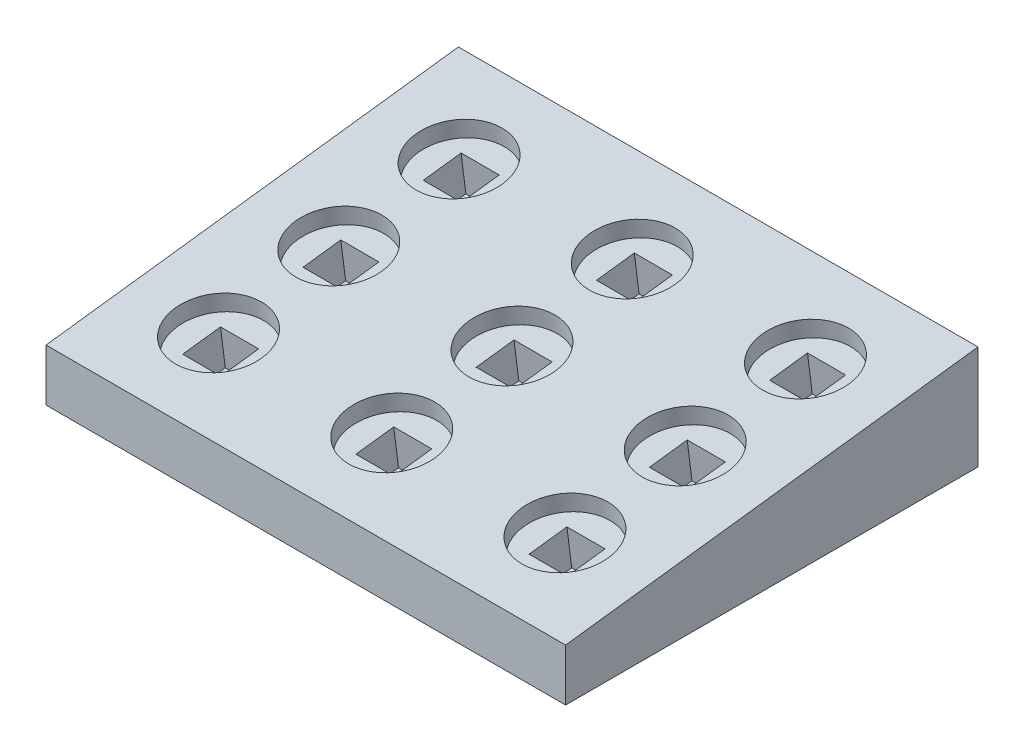
from build123d import *

# Parameters (mm, degrees)
BOSS_EXTRUDE1_DEPTH = 381
SKETCH2_R           = 31.75
SKETCH2_W           = 27.94
SKETCH2_H           = 27.94
CUT_EXTRUDE2_DEPTH  = 15.24
SKETCH2_3_W         = 27.94
SKETCH2_3_H         = 27.94
CUT_EXTRUDE3_DEPTH  = 43.18
SHELL1_T            = -3.81


with BuildPart() as part:
    # Sketch1 → Boss-Extrude1 (new body)
    with BuildSketch(Plane(origin=(0, 0, 0), x_dir=(0, 0, -1), z_dir=(1, 0, 0))):
        Polygon((0, 0), (0, 38.1), (302.409374855, 76.2), (302.409374855, 0), align=None)
    extrude(amount=BOSS_EXTRUDE1_DEPTH)

    # Sketch2 → Cut-Extrude2 (cut)
    # profile 1 of 9: a face of its own
    with BuildSketch(Plane(origin=(0, 40.024765624, 5.042646482), x_dir=(1, 0, 0), z_dir=(0, 0.9921567416492215, 0.12500000000000003))):
        with Locations((63.5, 246.0625)):
            Circle(SKETCH2_R)
        with Locations((63.5, 246.0625)):
            Rectangle(SKETCH2_W, SKETCH2_H, mode=Mode.SUBTRACT)
    # profile 2 of 9: a face of its own
    with BuildSketch(Plane(origin=(0, 40.024765624, 5.042646482), x_dir=(1, 0, 0), z_dir=(0, 0.9921567416492215, 0.12500000000000003))):
        with Locations((190.5, 246.0625)):
            Circle(SKETCH2_R)
        with Locations((190.5, 246.0625)):
            Rectangle(SKETCH2_W, SKETCH2_H, mode=Mode.SUBTRACT)
    # profile 3 of 9: a face of its own
    with BuildSketch(Plane(origin=(0, 40.024765624, 5.042646482), x_dir=(1, 0, 0), z_dir=(0, 0.9921567416492215, 0.12500000000000003))):
        with Locations((317.5, 246.0625)):
            Circle(SKETCH2_R)
        with Locations((317.5, 246.0625)):
            Rectangle(SKETCH2_W, SKETCH2_H, mode=Mode.SUBTRACT)
    # profile 4 of 9: a face of its own
    with BuildSketch(Plane(origin=(0, 40.024765624, 5.042646482), x_dir=(1, 0, 0), z_dir=(0, 0.9921567416492215, 0.12500000000000003))):
        with Locations((63.5, 157.1625)):
            Circle(SKETCH2_R)
        with Locations((63.5, 157.1625)):
            Rectangle(SKETCH2_W, SKETCH2_H, mode=Mode.SUBTRACT)
    # profile 5 of 9: a face of its own
    with BuildSketch(Plane(origin=(0, 40.024765624, 5.042646482), x_dir=(1, 0, 0), z_dir=(0, 0.9921567416492215, 0.12500000000000003))):
        with Locations((63.5, 68.2625)):
            Circle(SKETCH2_R)
        with Locations((63.5, 68.2625)):
            Rectangle(SKETCH2_W, SKETCH2_H, mode=Mode.SUBTRACT)
    # profile 6 of 9: a face of its own
    with BuildSketch(Plane(origin=(0, 40.024765624, 5.042646482), x_dir=(1, 0, 0), z_dir=(0, 0.9921567416492215, 0.12500000000000003))):
        with Locations((190.5, 157.1625)):
            Circle(SKETCH2_R)
        with Locations((190.5, 157.1625)):
            Rectangle(SKETCH2_W, SKETCH2_H, mode=Mode.SUBTRACT)
    # profile 7 of 9: a face of its own
    with BuildSketch(Plane(origin=(0, 40.024765624, 5.042646482), x_dir=(1, 0, 0), z_dir=(0, 0.9921567416492215, 0.12500000000000003))):
        with Locations((190.5, 68.2625)):
            Circle(SKETCH2_R)
        with Locations((190.5, 68.2625)):
            Rectangle(SKETCH2_W, SKETCH2_H, mode=Mode.SUBTRACT)
    # profile 8 of 9: a face of its own
    with BuildSketch(Plane(origin=(0, 40.024765624, 5.042646482), x_dir=(1, 0, 0), z_dir=(0, 0.9921567416492215, 0.12500000000000003))):
        with Locations((317.5, 68.2625)):
            Circle(SKETCH2_R)
        with Locations((317.5, 68.2625)):
            Rectangle(SKETCH2_W, SKETCH2_H, mode=Mode.SUBTRACT)
    # profile 9 of 9: a face of its own
    with BuildSketch(Plane(origin=(0, 40.024765624, 5.042646482), x_dir=(1, 0, 0), z_dir=(0, 0.9921567416492215, 0.12500000000000003))):
        with Locations((317.5, 157.1625)):
            Circle(SKETCH2_R)
        with Locations((317.5, 157.1625)):
            Rectangle(SKETCH2_W, SKETCH2_H, mode=Mode.SUBTRACT)
    extrude(amount=-CUT_EXTRUDE2_DEPTH, mode=Mode.SUBTRACT)

    # Sketch2<3> → Cut-Extrude3 (cut)
    with BuildSketch(Plane(origin=(0, 40.024765624, 5.042646482), x_dir=(1, 0, 0), z_dir=(0, 0.9921567416492215, 0.12500000000000003))):
        with Locations((317.5, 246.0625)):
            Rectangle(SKETCH2_3_W, SKETCH2_3_H)
        with Locations((190.5, 157.1625)):
            Rectangle(SKETCH2_3_W, SKETCH2_3_H)
        with Locations((317.5, 68.2625)):
            Rectangle(SKETCH2_3_W, SKETCH2_3_H)
        with Locations((190.5, 68.2625)):
            Rectangle(SKETCH2_3_W, SKETCH2_3_H)
        with Locations((190.5, 246.0625)):
            Rectangle(SKETCH2_3_W, SKETCH2_3_H)
        with Locations((63.5, 157.1625)):
            Rectangle(SKETCH2_3_W, SKETCH2_3_H)
        with Locations((317.5, 157.1625)):
            Rectangle(SKETCH2_3_W, SKETCH2_3_H)
        with Locations((63.5, 68.2625)):
            Rectangle(SKETCH2_3_W, SKETCH2_3_H)
        with Locations((63.5, 246.0625)):
            Rectangle(SKETCH2_3_W, SKETCH2_3_H)
    extrude(amount=-CUT_EXTRUDE3_DEPTH, mode=Mode.SUBTRACT)

    # Shell1
    shell1_openings = [part.faces().sort_by_distance(p)[0] for p in [
        (190.5, 0, -151.204687427),
    ]]
    offset(amount=SHELL1_T, openings=shell1_openings, kind=Kind.INTERSECTION)


solid = part.part
